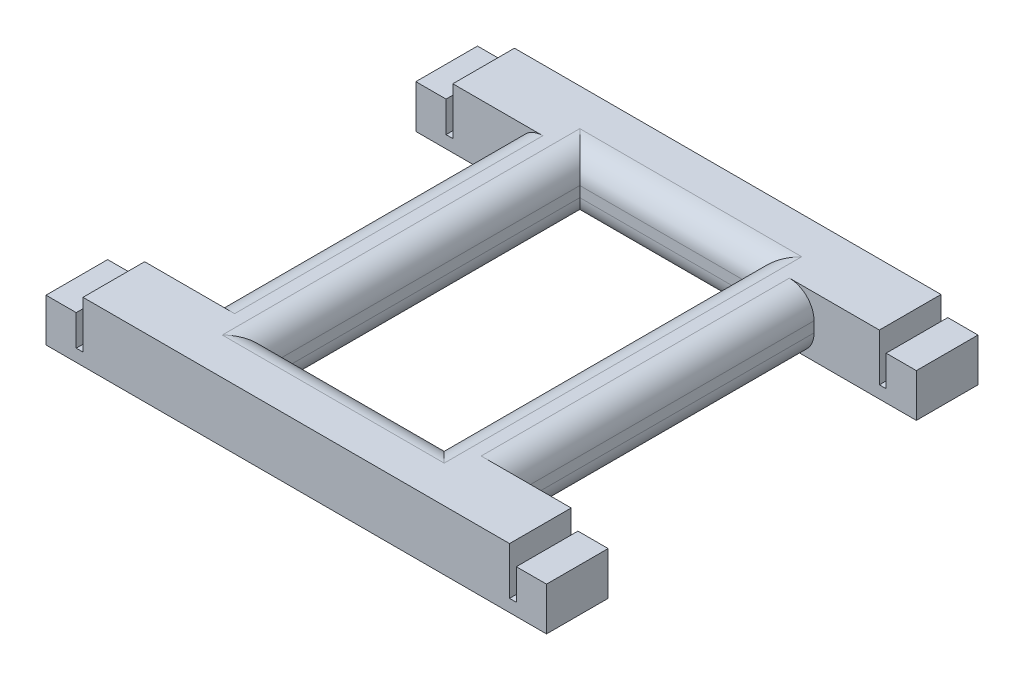
from build123d import *

# Parameters (mm, degrees)
BOSS_EXTRUDE1_DEPTH      = 19.25
BOSS_EXTRUDE1_DEPTH_BACK = 5
SKETCH1_W                = 70
SKETCH1_H                = 125
SKETCH2_W                = 15
SKETCH2_H                = 25
BOSS_EXTRUDE2_DEPTH      = 5
SKETCH3_W                = 12.25
SKETCH3_H                = 25
BOSS_EXTRUDE3_DEPTH      = 12.5
FILLET1_R                = 10


with BuildPart() as part:
    # Sketch1 → Boss-Extrude1 (new, two sides: drawn at the far end of the back side and taken through both)
    with BuildSketch(Plane(origin=(0, 0, 0), x_dir=(1, 0, 0), z_dir=(0, 1, 0)).offset(-BOSS_EXTRUDE1_DEPTH_BACK)):
        Polygon((-60, 62.5), (-60, -62.5), (-86.5, -62.5), (-86.5, -87.5), (86.5, -87.5), (86.5, -62.5), (60, -62.5), (60, 62.5), (86.5, 62.5), (86.5, 87.5), (-86.5, 87.5), (-86.5, 62.5), align=None)
        Rectangle(SKETCH1_W, SKETCH1_H, mode=Mode.SUBTRACT)
    extrude(amount=BOSS_EXTRUDE1_DEPTH + BOSS_EXTRUDE1_DEPTH_BACK)

    # Sketch2 → Boss-Extrude2 (add)
    with BuildSketch(Plane(origin=(0, -5, 0), x_dir=(1, 0, 0), z_dir=(0, 1, 0))):
        with Locations((-94, 75)):
            Rectangle(SKETCH2_W, SKETCH2_H)
        with Locations((94, 75)):
            Rectangle(SKETCH2_W, SKETCH2_H)
        with Locations((-94, -75)):
            Rectangle(SKETCH2_W, SKETCH2_H)
        with Locations((94, -75)):
            Rectangle(SKETCH2_W, SKETCH2_H)
    extrude(amount=BOSS_EXTRUDE2_DEPTH)

    # Sketch3 → Boss-Extrude3 (add)
    with BuildSketch(Plane(origin=(0, 0, 0), x_dir=(1, 0, 0), z_dir=(0, 1, 0))):
        with Locations((-95.375, 75)):
            Rectangle(SKETCH3_W, SKETCH3_H)
        with Locations((95.375, 75)):
            Rectangle(SKETCH3_W, SKETCH3_H)
        with Locations((-95.375, -75)):
            Rectangle(SKETCH3_W, SKETCH3_H)
        with Locations((95.375, -75)):
            Rectangle(SKETCH3_W, SKETCH3_H)
    extrude(amount=BOSS_EXTRUDE3_DEPTH)

    # Fillet1
    fillet1_edges = [part.edges().sort_by_distance(p)[0] for p in [
        (0, 19.25, 62.5),
        (60, 19.25, 0),
        (35, 19.25, 0),
        (-60, 19.25, 0),
        (-35, 19.25, 0),
        (0, 19.25, -62.5),
        (0, -5, 62.5),
        (-35, -5, 0),
        (0, -5, -62.5),
        (35, -5, 0),
        (60, -5, 0),
        (-60, -5, 0),
    ]]
    fillet(fillet1_edges, radius=FILLET1_R)


solid = part.part
